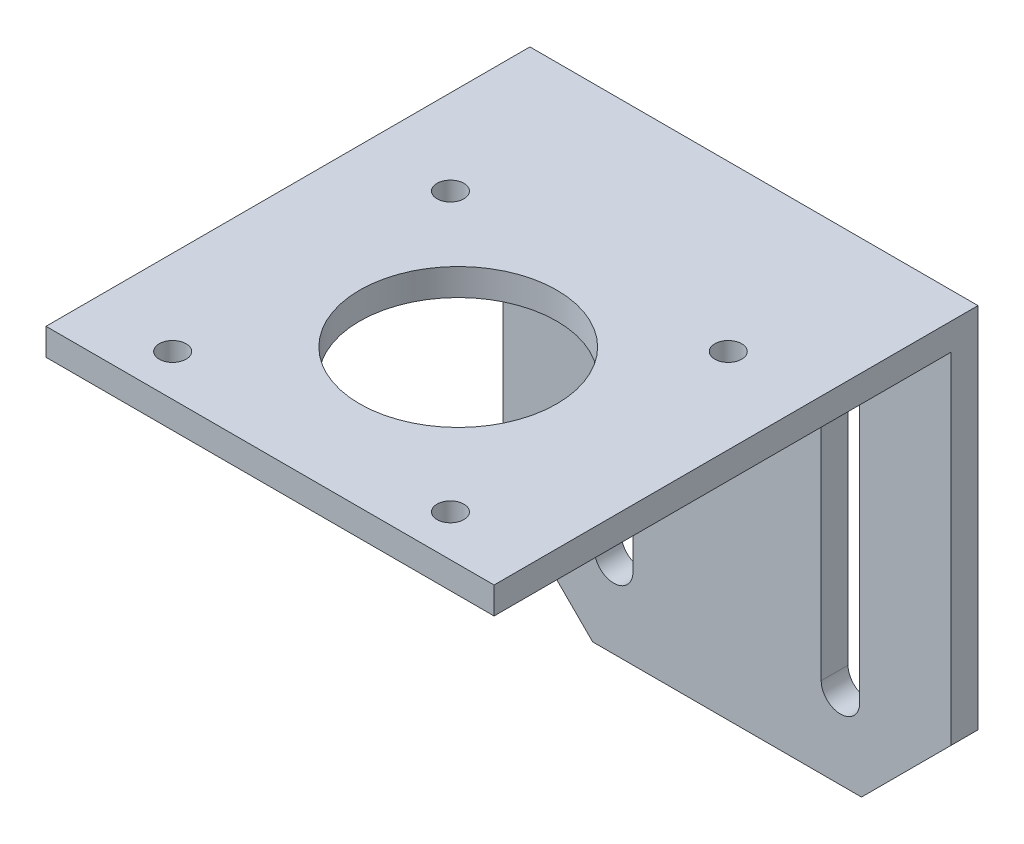
from build123d import *

# Parameters (mm, degrees)
SKETCH1_W               = 50
SKETCH1_H               = 51
BOSS_EXTRUDE1_DEPTH     = 3
CUT_EXTRUDE_THIN1_DEPTH = 3
SKETCH4_W               = 50
SKETCH4_H               = 3
BOSS_EXTRUDE2_DEPTH     = 51
SKETCH5_R               = 11
CUT_EXTRUDE1_DEPTH      = 77.452599694
CUT_EXTRUDE2_DEPTH      = 77.452599694
CUT_EXTRUDE2_DEPTH_BACK = 77.452599694
SKETCH6_R               = 1.5


with BuildPart() as part:
    # Sketch1 → Boss-Extrude1 (new body)
    with BuildSketch(Plane.XY):
        Rectangle(SKETCH1_W, SKETCH1_H)
        with BuildLine():
            Line((-10.5, 17.5), (-10.5, -16.5))
            ThreePointArc((-10.5, -16.5), (-12.65, -18.65), (-14.8, -16.5))
            Line((-14.8, -16.5), (-14.8, 17.5))
            ThreePointArc((-14.8, 17.5), (-12.65, 19.65), (-10.5, 17.5))
        make_face(mode=Mode.SUBTRACT)
        with BuildLine():
            Line((10.5, 17.5), (10.5, -16.5))
            ThreePointArc((10.5, -16.5), (12.65, -18.65), (14.8, -16.5))
            Line((14.8, -16.5), (14.8, 17.5))
            ThreePointArc((14.8, 17.5), (12.65, 19.65), (10.5, 17.5))
        make_face(mode=Mode.SUBTRACT)
    extrude(amount=BOSS_EXTRUDE1_DEPTH)

    # Sketch3 → Cut-Extrude-Thin1 (cut)
    with BuildSketch(Plane(origin=(0, 0, 0), x_dir=(-1, 0, 0), z_dir=(0, 0, -1))):
        Polygon((-25, -15.5), (-15, -25.5), (-22.071067812, -32.571067812), (-32.071067812, -22.571067812), align=None)
        Polygon((15, -25.5), (25, -15.5), (32.071067812, -22.571067812), (22.071067812, -32.571067812), align=None)
    extrude(amount=-CUT_EXTRUDE_THIN1_DEPTH, mode=Mode.SUBTRACT)

    # Sketch4 → Boss-Extrude2 (add)
    with BuildSketch(Plane.XY.offset(3)):
        with Locations((0, 24)):
            Rectangle(SKETCH4_W, SKETCH4_H)
    extrude(amount=BOSS_EXTRUDE2_DEPTH)

    # Sketch5 → Cut-Extrude1 (cut, through all)
    with BuildSketch(Plane.XZ.offset(-22.5)):
        with Locations((0, 33)):
            Circle(SKETCH5_R)
    extrude(amount=-CUT_EXTRUDE1_DEPTH, mode=Mode.SUBTRACT)

    # Sketch6 → Cut-Extrude2 (cut, two sides: drawn at the far end of the back side and taken through both)
    with BuildSketch(Plane.XZ.offset(-22.5).offset(-CUT_EXTRUDE2_DEPTH_BACK)):
        with Locations((-15.5, 49.36722171)):
            Circle(SKETCH6_R)
        with Locations((-15.5, 18.36722171)):
            Circle(SKETCH6_R)
        with Locations((15.5, 18.36722171)):
            Circle(SKETCH6_R)
        with Locations((15.5, 49.36722171)):
            Circle(SKETCH6_R)
    extrude(amount=CUT_EXTRUDE2_DEPTH + CUT_EXTRUDE2_DEPTH_BACK, mode=Mode.SUBTRACT)


solid = part.part
